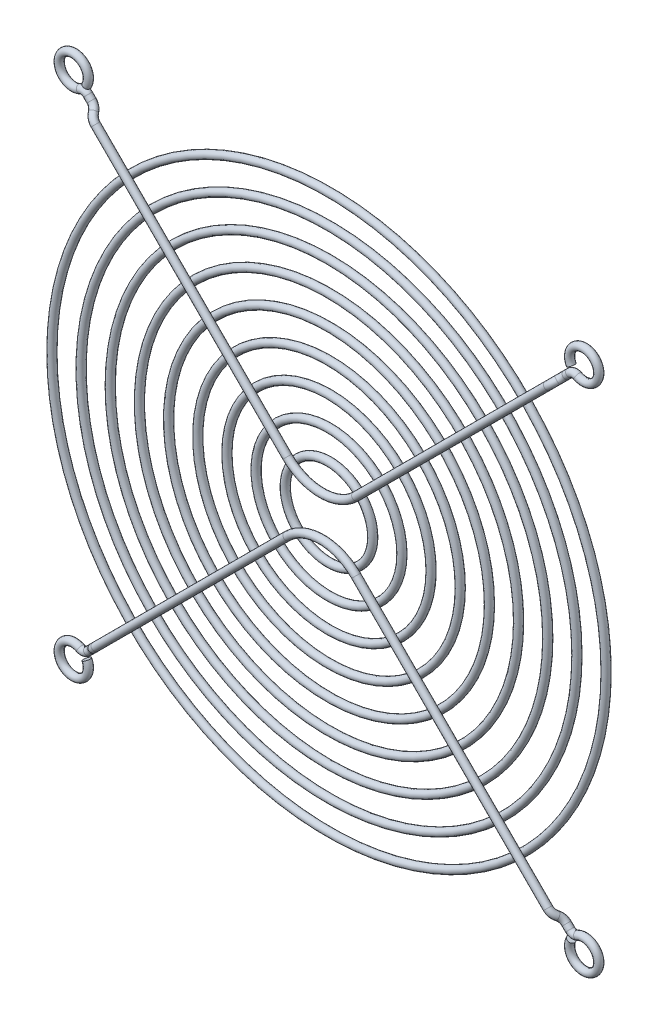
from build123d import *

# Parameters (mm, degrees)
SKETCH2_R  = 0.75
SKETCH3_R  = 0.75
SKETCH4_R  = 0.75
SKETCH5_R  = 0.75
SKETCH7_R  = 0.75
SKETCH8_R  = 0.75
SKETCH9_R  = 0.75
SKETCH10_R = 0.75
SKETCH23_R = 0.75
SKETCH12_R = 0.75
SKETCH15_R = 0.75
SKETCH20_R = 0.75
SKETCH22_R = 0.75


with BuildPart() as part:
    # Sketch2 → Revolve1 (revolve)
    with BuildSketch(Plane(origin=(0, 0, 0), x_dir=(1, 0, 0), z_dir=(0, 1, 0)), mode=Mode.PRIVATE) as revolve1_sk:
        with Locations((-9, 0)):
            Circle(SKETCH2_R)
    revolve(revolve1_sk.sketch.rotate(Axis((0, 0, 2.4), (0, 0, -1)), 180), axis=Axis((0, 0, 2.4), (0, 0, -1)))


with BuildPart() as body_2:
    # Sketch3 → Revolve2 (revolve)
    with BuildSketch(Plane(origin=(0, 0, 0), x_dir=(1, 0, 0), z_dir=(0, 1, 0)), mode=Mode.PRIVATE) as revolve2_sk:
        with Locations((-15, 0)):
            Circle(SKETCH3_R)
    revolve(revolve2_sk.sketch.rotate(Axis((0, 0, 2.4), (0, 0, -1)), 180), axis=Axis((0, 0, 2.4), (0, 0, -1)))


with BuildPart() as body_3:
    # Sketch4 → Revolve3 (revolve)
    with BuildSketch(Plane(origin=(0, 0, 0), x_dir=(1, 0, 0), z_dir=(0, 1, 0)), mode=Mode.PRIVATE) as revolve3_sk:
        with Locations((-21, 0)):
            Circle(SKETCH4_R)
    revolve(revolve3_sk.sketch.rotate(Axis((0, 0, 2.4), (0, 0, -1)), 180), axis=Axis((0, 0, 2.4), (0, 0, -1)))


with BuildPart() as body_4:
    # Sketch5 → Revolve4 (revolve)
    with BuildSketch(Plane(origin=(0, 0, 0), x_dir=(1, 0, 0), z_dir=(0, 1, 0)), mode=Mode.PRIVATE) as revolve4_sk:
        with Locations((-27, 0)):
            Circle(SKETCH5_R)
    revolve(revolve4_sk.sketch.rotate(Axis((0, 0, 2.4), (0, 0, -1)), 180), axis=Axis((0, 0, 2.4), (0, 0, -1)))


with BuildPart() as body_5:
    # Sketch7 → Revolve5 (revolve)
    with BuildSketch(Plane(origin=(0, 0, 0), x_dir=(1, 0, 0), z_dir=(0, 1, 0)), mode=Mode.PRIVATE) as revolve5_sk:
        with Locations((-33, 0)):
            Circle(SKETCH7_R)
    revolve(revolve5_sk.sketch.rotate(Axis((0, 0, 2.4), (0, 0, -1)), 180), axis=Axis((0, 0, 2.4), (0, 0, -1)))


with BuildPart() as body_6:
    # Sketch8 → Revolve6 (revolve)
    with BuildSketch(Plane(origin=(0, 0, 0), x_dir=(1, 0, 0), z_dir=(0, 1, 0)), mode=Mode.PRIVATE) as revolve6_sk:
        with Locations((-39, 0)):
            Circle(SKETCH8_R)
    revolve(revolve6_sk.sketch.rotate(Axis((0, 0, 2.4), (0, 0, -1)), 180), axis=Axis((0, 0, 2.4), (0, 0, -1)))


with BuildPart() as body_7:
    # Sketch9 → Revolve7 (revolve)
    with BuildSketch(Plane(origin=(0, 0, 0), x_dir=(1, 0, 0), z_dir=(0, 1, 0)), mode=Mode.PRIVATE) as revolve7_sk:
        with Locations((-45, 0)):
            Circle(SKETCH9_R)
    revolve(revolve7_sk.sketch.rotate(Axis((0, 0, 2.4), (0, 0, -1)), 180), axis=Axis((0, 0, 2.4), (0, 0, -1)))


with BuildPart() as body_8:
    # Sketch10 → Revolve8 (revolve)
    with BuildSketch(Plane(origin=(0, 0, 0), x_dir=(1, 0, 0), z_dir=(0, 1, 0)), mode=Mode.PRIVATE) as revolve8_sk:
        with Locations((-51, 0)):
            Circle(SKETCH10_R)
    revolve(revolve8_sk.sketch.rotate(Axis((0, 0, 2.4), (0, 0, -1)), 180), axis=Axis((0, 0, 2.4), (0, 0, -1)))


with BuildPart() as body_9:
    # Sketch23 → Revolve9 (revolve)
    with BuildSketch(Plane(origin=(0, 0, 0), x_dir=(1, 0, 0), z_dir=(0, 1, 0)), mode=Mode.PRIVATE) as revolve9_sk:
        with Locations((-57, 0)):
            Circle(SKETCH23_R)
    revolve(revolve9_sk.sketch.rotate(Axis((0, 0, 2.4), (0, 0, -1)), 180), axis=Axis((0, 0, 2.4), (0, 0, -1)))


with BuildPart() as body_10:
    # Sweep1: sweep along a path in Sketch11
    with BuildLine(Plane.XY.offset(1.5)) as sweep1_path:
        Line((-39.597979746, 39.597979746), (-7.071067812, 7.071067812))
        ThreePointArc((-7.071067812, 7.071067812), (-3.826834324, 4.903340299), (0, 4.142135624))
    # Sketch12 → Sweep1 (sweep)
    with BuildSketch(Plane(origin=(0, 0, 0), x_dir=(0, 0, -1), z_dir=(1, 0, 0))):
        with Locations((-1.5, 4.142135624)):
            Circle(SKETCH12_R)
    sweep(path=sweep1_path.line)



with BuildPart() as body_11:
    # Sweep3: sweep along a path in Sketch13
    with BuildLine(Plane.XY) as sweep3_path:
        ThreePointArc((-49.826980427, 51.138028501), (-54.621320344, 54.621320344), (-51.138028501, 49.826980427))
    # Sketch15 → Sweep3 (sweep)
    with BuildSketch(Plane(origin=(10.416058975, 20.44266677, 0), x_dir=(0, 0, 1), z_dir=(0.4539904997395446, 0.891006524188369, 0))):
        with Locations((0, -67.612343756)):
            Circle(SKETCH15_R)
    sweep(path=sweep3_path.line)

    # Sweep4: sweep along a path in Sketch19
    with BuildLine(Plane.XY) as sweep4_path:
        Line((-48.87314625, 48.87314625), (-49.580253032, 49.580253032))
        ThreePointArc((-49.580253032, 49.580253032), (-50.319057471, 49.956692696), (-51.138028501, 49.826980427))
    # Sketch20 → Sweep4 (sweep)
    with BuildSketch(Plane(origin=(-20.44266677, -10.416058975, 0), x_dir=(0, 0, -1), z_dir=(0.8910065241883685, 0.45399049973954597, 0))):
        with Locations((0, 67.612343756)):
            Circle(SKETCH20_R)
    sweep(path=sweep4_path.line)


with BuildPart() as body_10_1:
    add(body_10.part)

    add(body_11.part)  # Sweep5 merges body 11
    # Sweep5: sweep along a path in Sketch21
    with BuildLine(Plane(origin=(0, 0, 0), x_dir=(0, 0, -1), z_dir=(0.7071067811865464, 0.7071067811865488, 0))) as sweep5_path:
        Line((-1.5, 56), (-1.5, 65.807987842))
        ThreePointArc((-1.5, 65.807987842), (-1.303746491, 66.716282948), (-0.75, 67.462527052))
        ThreePointArc((-0.75, 67.462527052), (-0.196253509, 68.208771157), (0, 69.117066263))
    # Sketch22 → Sweep5 (sweep)
    with BuildSketch(Plane(origin=(-48.87314625, 48.87314625, 0), x_dir=(0, 0, -1), z_dir=(0.7071067811865712, -0.7071067811865239, 0))):
        Circle(SKETCH22_R)
    sweep(path=sweep5_path.line)

    # Mirror1: body 10 across plane


with BuildPart() as body_10_2:
    add(body_10_1.part)
    add(body_10_1.part.mirror(Plane(origin=(0, 4.142135624, 1.5), x_dir=(0, 0, 1), z_dir=(1, 0, 0))))


with BuildPart() as body_11_2:
    # Mirror2: mirrored copy
    add(body_10_2.part.mirror(Plane.ZX))


solid = Compound([part.part, body_2.part, body_3.part, body_4.part, body_5.part, body_6.part, body_7.part, body_8.part, body_9.part, body_10_2.part, body_11_2.part])
